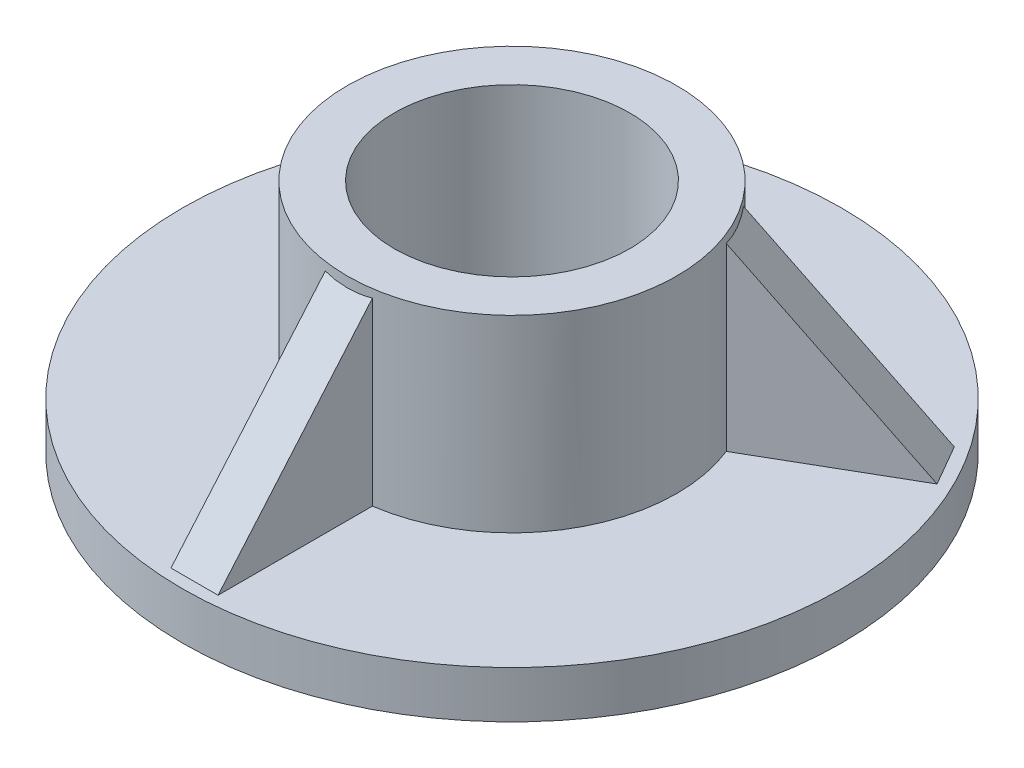
from build123d import *

# Parameters (mm, degrees)
SKETCH_1_R               = 70
SKETCH_1_R_2             = 35
EXTRUDE_1_DEPTH          = 10
SKETCH_1_3_R             = 35
SKETCH_1_3_R_2           = 25
EXTRUDE_2_DEPTH          = 50
RIB_13_REACH             = 112.905
SKETCH_2_WALL_W          = 273.614682576
SKETCH_2_WALL_H          = 10
PATTERN_CIRCULAR_1_COUNT = 3


with BuildPart() as part:
    # 草图1 → 凸台-拉伸1 (new body)
    with BuildSketch(Plane(origin=(0, 0, 0), x_dir=(1, 0, 0), z_dir=(0, 1, 0))):
        Circle(SKETCH_1_R)
        Circle(SKETCH_1_R_2, mode=Mode.SUBTRACT)
    extrude(amount=EXTRUDE_1_DEPTH)

    # 草图1<3> → 凸台-拉伸2 (add)
    with BuildSketch(Plane(origin=(0, 0, 0), x_dir=(1, 0, 0), z_dir=(0, 1, 0))):
        Circle(SKETCH_1_3_R)
        Circle(SKETCH_1_3_R_2, mode=Mode.SUBTRACT)
    extrude(amount=EXTRUDE_2_DEPTH)

    # 草图2 wall → 筋13 (add, up to next)
    with BuildSketch(Plane(origin=(0, 28.909855829, 51.202647079), x_dir=(0, -0.7593716924, 0.650657077716), z_dir=(0, -0.650657077716, -0.7593716924)), mode=Mode.PRIVATE) as rib_13_sk1:
        Rectangle(SKETCH_2_WALL_W, SKETCH_2_WALL_H)
    rib_13_tool1 = extrude(rib_13_sk1.sketch, amount=RIB_13_REACH, mode=Mode.PRIVATE) - part.part
    rib_13 = rib_13_tool1.solids().sort_by_distance((0, 28.909855829, 51.202647079))[0]
    add(rib_13)

    # 阵列(圆周)1: 筋13 ×3 about axis
    pattern_circular_1_axis = Axis((0, 50, 0), (0, -1, 0))
    for i in range(1, PATTERN_CIRCULAR_1_COUNT):
        add(rib_13.rotate(pattern_circular_1_axis, i * 360 / PATTERN_CIRCULAR_1_COUNT))


solid = part.part
